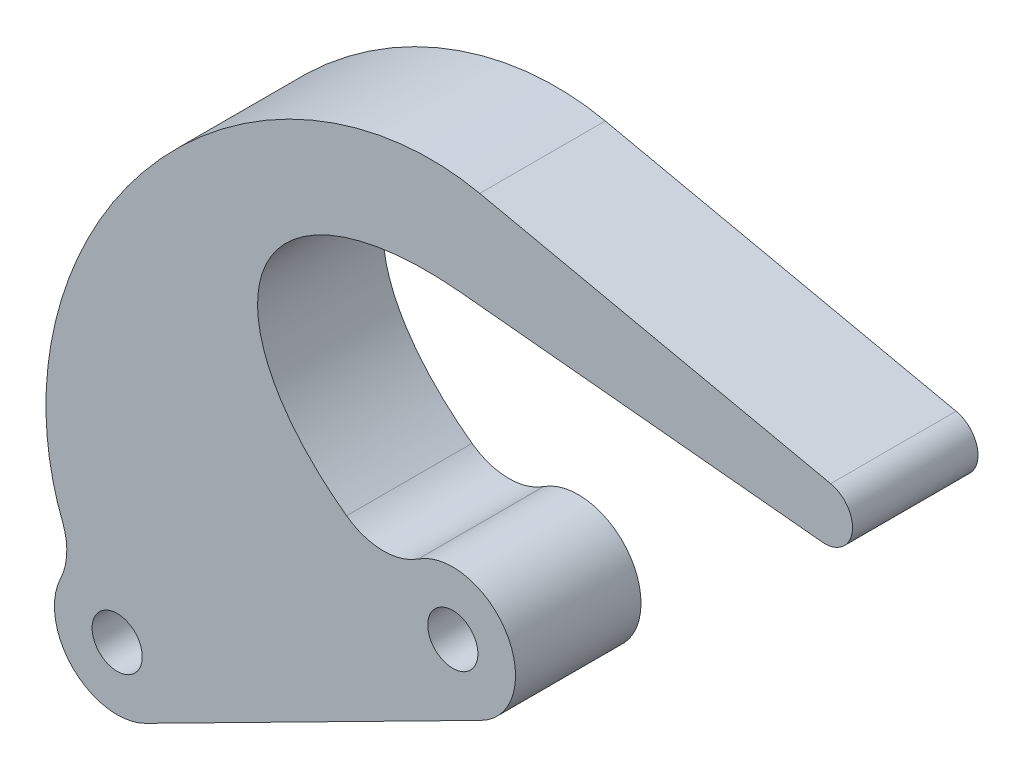
from build123d import *

# Parameters (mm, degrees)
SKETCH1_R           = 2
BOSS_EXTRUDE1_DEPTH = 10


with BuildPart() as part:
    # Sketch1 → Boss-Extrude1 (new body)
    with BuildSketch(Plane.XY):
        with BuildLine():
            Line((1.997609294, 14.746687389), (28.748065289, 28.326566036))
            ThreePointArc((28.748065289, 28.326566036), (30.805734405, 35.300748137), (23.724834089, 36.954250141))
            ThreePointArc((23.724834089, 36.954250141), (20.851278613, 36.124816425), (18.018383872, 37.083976864))
            add(Edge.make_bspline(
                [(27.096341183, 57.0558637), (-15.03027812, 61.190372697), (18.018383872, 37.083976864)],
                knots=[5.074507124, 5.074507124, 5.074507124, 7.365213451, 7.365213451, 7.365213451], degree=2, weights=[1, 0.41272448, 1]))
            Line((27.096341183, 57.0558637), (55.915354023, 54.227427195))
            ThreePointArc((55.915354023, 54.227427195), (58.317172637, 56.086683182), (56.599353473, 58.591610886))
            Line((56.599353473, 58.591610886), (28.633722858, 64.642950152))
            add(Edge.make_bspline(
                [(28.633722858, 64.642950152), (-24.600856245, 76.162107481), (-4.624928751, 25.368416784)],
                knots=[3.507798101, 3.507798101, 3.507798101, 5.909316529, 5.909316529, 5.909316529], degree=2, weights=[1, 0.361650033, 1]))
            ThreePointArc((-4.624928751, 25.368416784), (-4.281398653, 23.35476873), (-4.7718634, 21.371782158))
            ThreePointArc((-4.7718634, 21.371782158), (-3.762925605, 15.631661435), (1.997609294, 14.746687389))
        make_face()
        with Locations((-0.265703814, 19.205096721)):
            Circle(SKETCH1_R, mode=Mode.SUBTRACT)
        with Locations((26.484752181, 32.784975369)):
            Circle(SKETCH1_R, mode=Mode.SUBTRACT)
    extrude(amount=BOSS_EXTRUDE1_DEPTH)


solid = part.part
